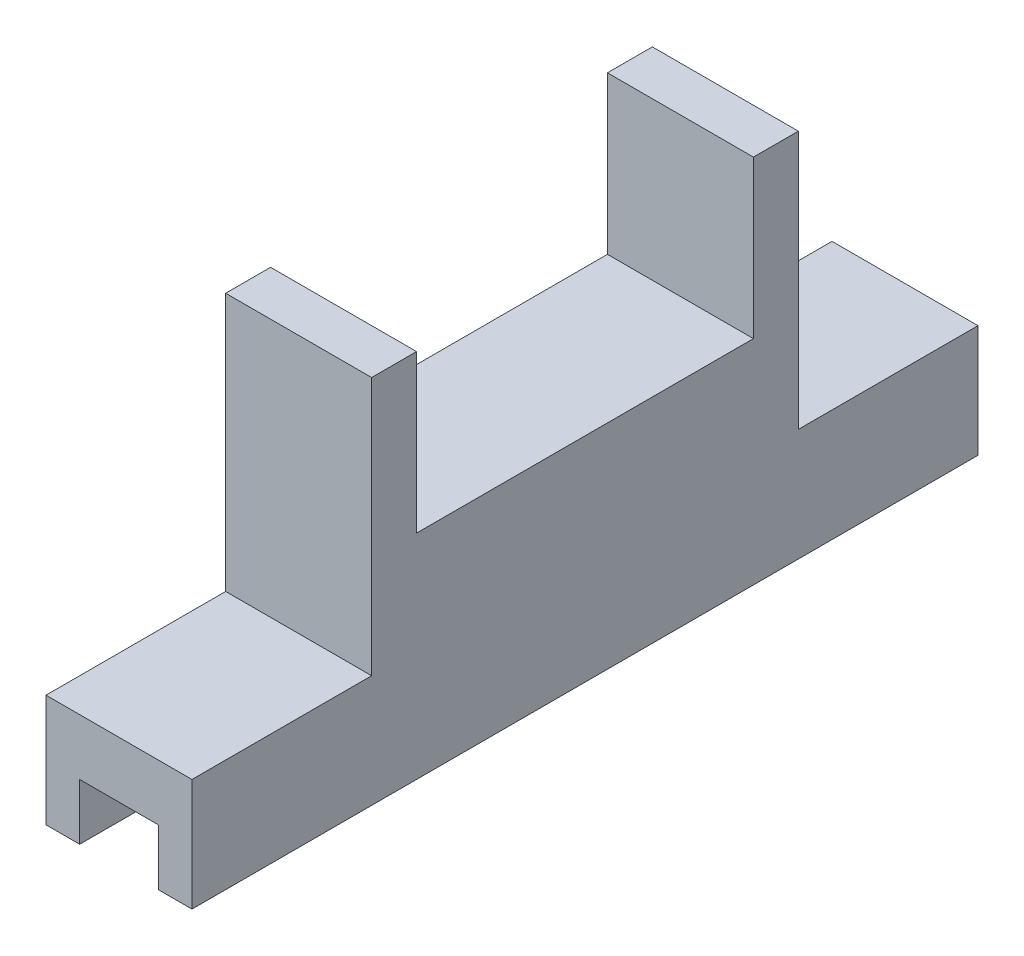
from build123d import *

# Parameters (mm, degrees)
SKETCH_1_W          = 6.5
SKETCH_1_H          = 35
EXTRUDE_1_DEPTH     = 6
SKETCH_2_W          = 2.5
SKETCH_2_H          = 2.967804408
CUT_EXTRUDE_1_DEPTH = 61
SKETCH_3_W          = 6.5
SKETCH_3_H          = 15
EXTRUDE_2_DEPTH     = 4.5
SKETCH_4_W          = 6.5
SKETCH_4_H          = 1
CUT_EXTRUDE_2_DEPTH = 503.5
SKETCH_5_W          = 6.5
SKETCH_5_H          = 2
EXTRUDE_3_DEPTH     = 11.5
SKETCH_6_W          = 6.5
SKETCH_6_H          = 2
EXTRUDE_4_DEPTH     = 11.5
SKETCH_7_W          = 3.5
SKETCH_7_H          = 2.5
CUT_EXTRUDE_3_DEPTH = 90.5


with BuildPart() as part:
    # Эскиз1 → Бобышка-Вытянуть1 (new body)
    with BuildSketch(Plane(origin=(0, 0, 0), x_dir=(1, 0, 0), z_dir=(0, 1, 0))):
        with Locations((-18.856267111, 10.244186047)):
            Rectangle(SKETCH_1_W, SKETCH_1_H)
    extrude(amount=EXTRUDE_1_DEPTH)

    # Эскиз2 → Вырез-Вытянуть1 (cut)
    with BuildSketch(Plane.XY.offset(7.255813953)):
        with Locations((-18.856267111, 1.483902204)):
            Rectangle(SKETCH_2_W, SKETCH_2_H)
    extrude(amount=-CUT_EXTRUDE_1_DEPTH, mode=Mode.SUBTRACT)

    # Эскиз3 → Бобышка-Вытянуть2 (add)
    with BuildSketch(Plane(origin=(0, 6, 0), x_dir=(1, 0, 0), z_dir=(0, 1, 0))):
        with Locations((-18.856267111, 10.244186047)):
            Rectangle(SKETCH_3_W, SKETCH_3_H)
    extrude(amount=EXTRUDE_2_DEPTH)

    # Эскиз4 → Вырез-Вытянуть2 (cut)
    with BuildSketch(Plane.XY.offset(7.255813953)):
        with Locations((-18.856267111, 0.5)):
            Rectangle(SKETCH_4_W, SKETCH_4_H)
    extrude(amount=-CUT_EXTRUDE_2_DEPTH, mode=Mode.SUBTRACT)

    # Эскиз5 → Бобышка-Вытянуть3 (add)
    with BuildSketch(Plane(origin=(0, 6, 0), x_dir=(1, 0, 0), z_dir=(0, 1, 0))):
        with Locations((-18.856267111, 18.744186047)):
            Rectangle(SKETCH_5_W, SKETCH_5_H)
    extrude(amount=EXTRUDE_3_DEPTH)

    # Эскиз6 → Бобышка-Вытянуть4 (add)
    with BuildSketch(Plane(origin=(0, 6, 0), x_dir=(1, 0, 0), z_dir=(0, 1, 0))):
        with Locations((-18.856267111, 1.744186047)):
            Rectangle(SKETCH_6_W, SKETCH_6_H)
    extrude(amount=EXTRUDE_4_DEPTH)

    # Эскиз7 → Вырез-Вытянуть3 (cut)
    with BuildSketch(Plane.XY.offset(7.255813953)):
        with Locations((-18.856267111, 2.25)):
            Rectangle(SKETCH_7_W, SKETCH_7_H)
    extrude(amount=-CUT_EXTRUDE_3_DEPTH, mode=Mode.SUBTRACT)


solid = part.part
